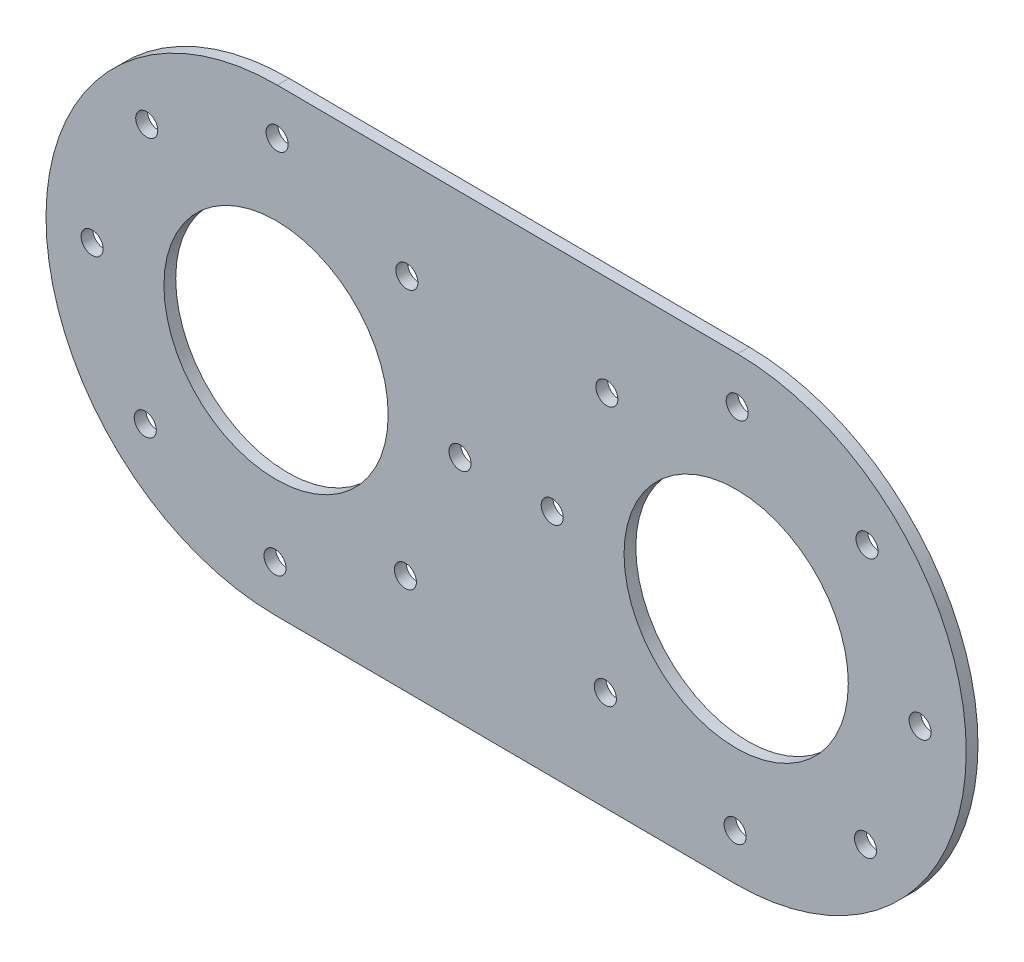
from build123d import *

# Parameters (mm, degrees)
SKETCH1_R           = 0.75
SKETCH1_R_2         = 7.62
BOSS_EXTRUDE1_DEPTH = 0.8


with BuildPart() as part:
    # Sketch1 → Boss-Extrude1 (new body)
    with BuildSketch(Plane.XY):
        with BuildLine():
            Line((-0.08854439, -19.128525646), (31.178350927, -19.305614409))
            ThreePointArc((31.178350927, -19.305614409), (46.900344572, -3.760709545), (31.355439708, 11.961284099))
            Line((31.355439708, 11.961284099), (0.08854439, 12.138372862))
            ThreePointArc((0.08854439, 12.138372862), (-15.633449254, -3.406532002), (-0.08854439, -19.128525646))
        make_face()
        with Locations((12.5, -3.565873621)):
            Circle(SKETCH1_R, mode=Mode.SUBTRACT)
        with Locations((0, -3.495076392)):
            Circle(SKETCH1_R_2, mode=Mode.SUBTRACT)
        with Locations((-12.5, -3.424279164)):
            Circle(SKETCH1_R, mode=Mode.SUBTRACT)
        with Locations((18.766895317, -3.601367926)):
            Circle(SKETCH1_R, mode=Mode.SUBTRACT)
        with Locations((31.266895317, -3.672165155)):
            Circle(SKETCH1_R_2, mode=Mode.SUBTRACT)
        with Locations((43.766895317, -3.742962383)):
            Circle(SKETCH1_R, mode=Mode.SUBTRACT)
        with Locations((31.196098089, -16.172165155)):
            Circle(SKETCH1_R, mode=Mode.SUBTRACT)
        with Locations((22.377999352, -12.460938719)):
            Circle(SKETCH1_R, mode=Mode.SUBTRACT)
        with Locations((40.055668882, -12.56106112)):
            Circle(SKETCH1_R, mode=Mode.SUBTRACT)
        with Locations((22.478121753, 5.21673081)):
            Circle(SKETCH1_R, mode=Mode.SUBTRACT)
        with Locations((40.155791283, 5.11660841)):
            Circle(SKETCH1_R, mode=Mode.SUBTRACT)
        with Locations((31.337692546, 8.827834845)):
            Circle(SKETCH1_R, mode=Mode.SUBTRACT)
        with Locations((8.788773564, -12.383972357)):
            Circle(SKETCH1_R, mode=Mode.SUBTRACT)
        with Locations((-0.070797229, -15.995076392)):
            Circle(SKETCH1_R, mode=Mode.SUBTRACT)
        with Locations((-8.888895965, -12.283849957)):
            Circle(SKETCH1_R, mode=Mode.SUBTRACT)
        with Locations((0.070797229, 9.004923608)):
            Circle(SKETCH1_R, mode=Mode.SUBTRACT)
        with Locations((8.888895965, 5.293697172)):
            Circle(SKETCH1_R, mode=Mode.SUBTRACT)
        with Locations((-8.788773564, 5.393819573)):
            Circle(SKETCH1_R, mode=Mode.SUBTRACT)
    extrude(amount=BOSS_EXTRUDE1_DEPTH)


solid = part.part
